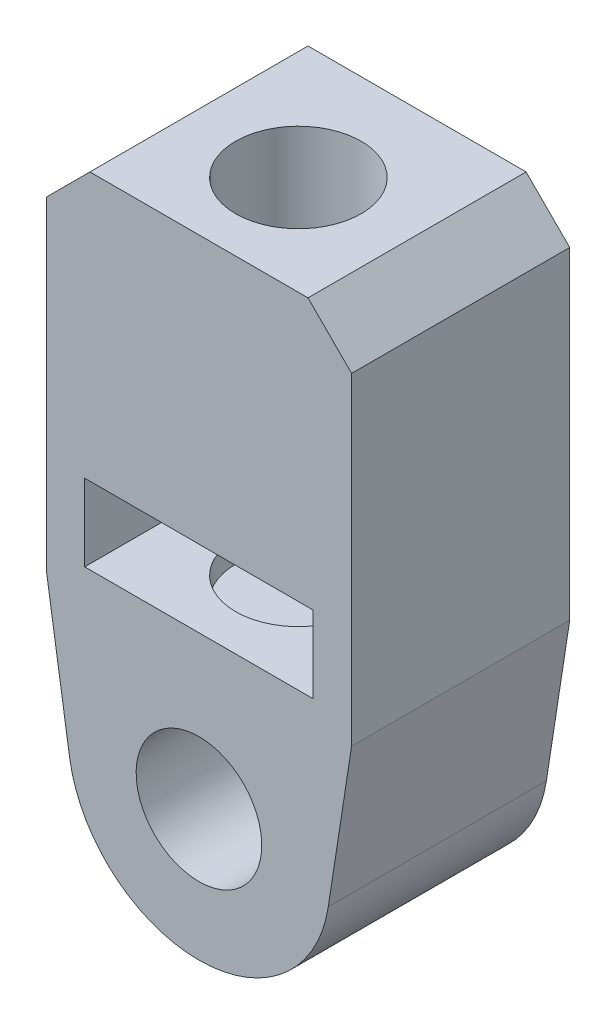
from build123d import *

# Parameters (mm, degrees)
SKETCH1_R           = 2.286
BOSS_EXTRUDE1_DEPTH = 7.9375
SKETCH2_R           = 2.286
CUT_EXTRUDE1_DEPTH  = 13.335
CUT_EXTRUDE2_START  = 0.79375
CUT_EXTRUDE2_DEPTH  = 2.794
CHAMFER1_SIZE       = 1.5875


with BuildPart() as part:
    # Sketch1 → Boss-Extrude1 (new body)
    with BuildSketch(Plane.XY):
        with BuildLine():
            Line((-5.55625, 4.7625), (-5.55625, 18.0975))
            Line((-5.55625, 18.0975), (5.55625, 18.0975))
            Line((5.55625, 18.0975), (5.55625, 4.7625))
            Line((5.55625, 4.7625), (4.706470588, -0.728382353))
            ThreePointArc((4.706470588, -0.728382353), (0, -4.7625), (-4.706470588, -0.728382353))
            Line((-4.706470588, -0.728382353), (-5.55625, 4.7625))
        make_face()
        with Locations(Location((0, 0, 0), (0, 0, 270))):
            Circle(SKETCH1_R, mode=Mode.SUBTRACT)
    extrude(amount=BOSS_EXTRUDE1_DEPTH)

    # Sketch2 → Cut-Extrude1 (cut)
    with BuildSketch(Plane(origin=(0, 18.0975, 0), x_dir=(1, 0, 0), z_dir=(0, 1, 0))):
        with Locations(Location((2.54e-07, -4.318750409, 0), (0, 0, 270))):
            Circle(SKETCH2_R)
    extrude(amount=-CUT_EXTRUDE1_DEPTH, mode=Mode.SUBTRACT)

    # Sketch3 → Cut-Extrude2 (cut)
    with BuildSketch(Plane(origin=(0, 4.7625, 0), x_dir=(1, 0, 0), z_dir=(0, 1, 0)).offset(CUT_EXTRUDE2_START)):
        Polygon((-1.906410334, -1.016750409), (-4.156524955, -4.914063255), (-4.156524955, -7.9375), (4.156521786, -7.9375), (4.156521786, -4.914056884), (1.906410843, -1.016750409), align=None)
    extrude(amount=CUT_EXTRUDE2_DEPTH, mode=Mode.SUBTRACT)

    # Chamfer1
    chamfer1_edges = [part.edges().sort_by_distance(p)[0] for p in [
        (-5.55625, 18.0975, 3.96875),
        (5.55625, 18.0975, 3.96875),
    ]]
    chamfer(chamfer1_edges, length=CHAMFER1_SIZE)


solid = part.part
